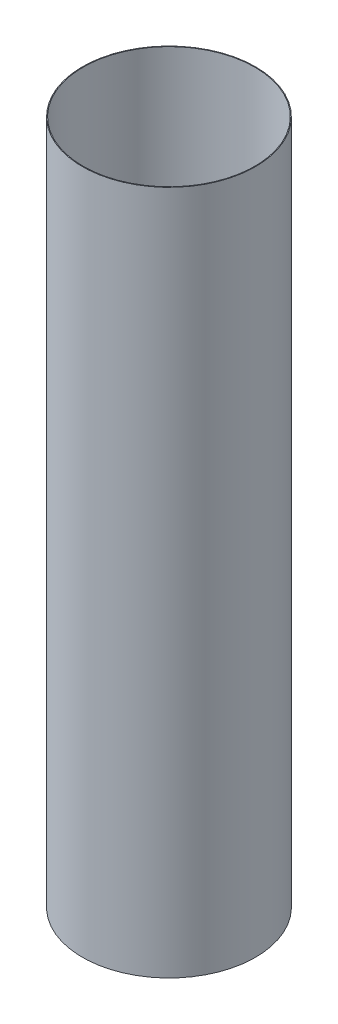
from build123d import *

# Parameters (mm, degrees)
SKETCH1_W             = 11
SKETCH1_H             = 87
ESBO_O1_R             = 10.91
CORTE_EXTRUS_O1_DEPTH = 87


with BuildPart() as part:
    # Sketch1 → Revolve4 (revolve)
    with BuildSketch(Plane.XY, mode=Mode.PRIVATE) as revolve4_sk:
        with Locations((5.5, 43.5)):
            Rectangle(SKETCH1_W, SKETCH1_H)
    revolve(revolve4_sk.sketch.rotate(Axis((11, 0, 0), (0, 1, 0)), 270), axis=Axis((11, 0, 0), (0, 1, 0)))

    # Esboço1 → Corte-extrusão1 (cut)
    with BuildSketch(Plane(origin=(0, 87, 0), x_dir=(1, 0, 0), z_dir=(0, 1, 0))):
        with Locations(Location((11, 0, 0), (0, 0, 270))):
            Circle(ESBO_O1_R)
    extrude(amount=-CORTE_EXTRUS_O1_DEPTH, mode=Mode.SUBTRACT)


solid = part.part
